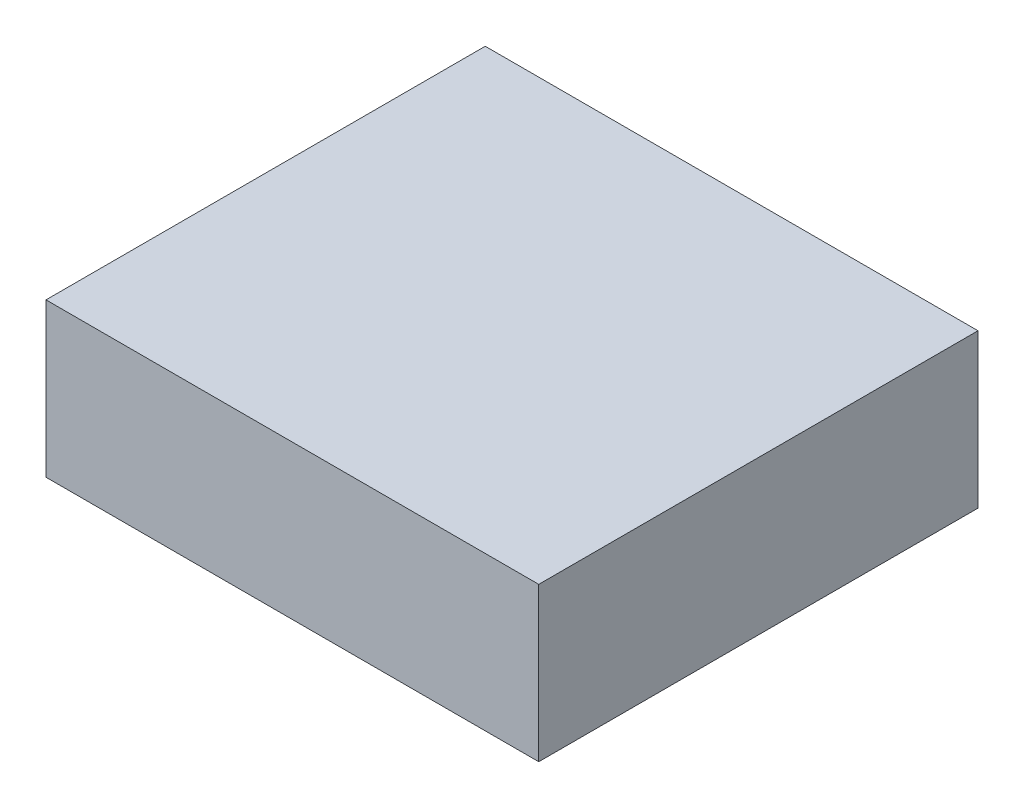
from build123d import *

# Parameters (mm, degrees)
SKETCH1_W           = 127.078191072
SKETCH1_H           = 113.282646321
BOSS_EXTRUDE1_DEPTH = 39.624


with BuildPart() as part:
    # Sketch1 → Boss-Extrude1 (new body)
    with BuildSketch(Plane(origin=(0, 0, 0), x_dir=(1, 0, 0), z_dir=(0, 1, 0))):
        with Locations((1.06119575, 7.295720781)):
            Rectangle(SKETCH1_W, SKETCH1_H)
    extrude(amount=BOSS_EXTRUDE1_DEPTH)


solid = part.part
